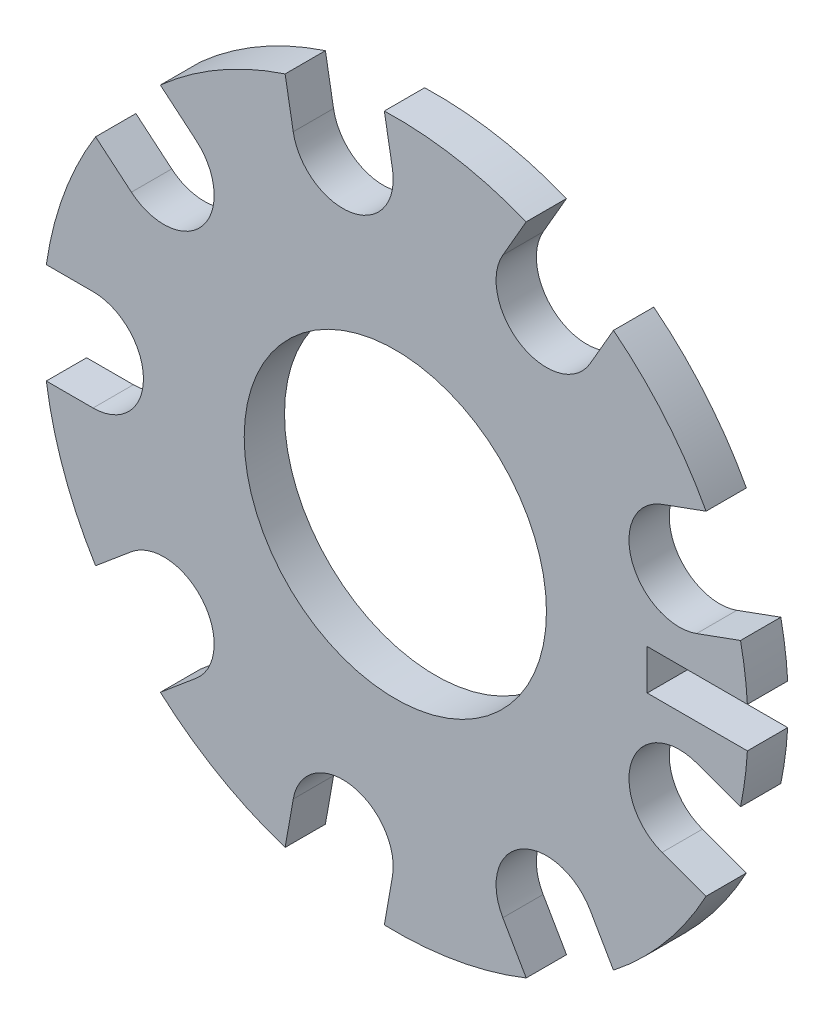
from build123d import *

# Parameters (mm, degrees)
SKETCH1_R           = 17.5
BOSS_EXTRUDE1_DEPTH = 2
CUT_EXTRUDE2_START  = -5
CUT_EXTRUDE2_DEPTH  = 5
SKETCH4_R           = 7.5
CUT_EXTRUDE3_DEPTH  = 5
CUT_EXTRUDE5_START  = -2
CUT_EXTRUDE5_DEPTH  = 2
CIRPATTERN4_COUNT   = 9


with BuildPart() as part:
    # Sketch1 → Boss-Extrude1 (new body)
    with BuildSketch(Plane.XY):
        Circle(SKETCH1_R)
    extrude(amount=BOSS_EXTRUDE1_DEPTH)

    # Sketch3 → Cut-Extrude2 (cut)
    with BuildSketch(Plane.XY.offset(2).offset(CUT_EXTRUDE2_START)):
        with BuildLine():
            Line((12.5, -1), (17.47140521, -1))
            ThreePointArc((17.47140521, -1), (17.492849842, -0.500204374), (17.5, 0))
            ThreePointArc((17.5, 0), (17.492849842, 0.500204374), (17.47140521, 1))
            Line((17.47140521, 1), (12.5, 1))
            Line((12.5, 1), (12.5, -1))
        make_face()
    extrude(amount=CUT_EXTRUDE2_DEPTH, mode=Mode.SUBTRACT)

    # Sketch4 → Cut-Extrude3 (cut)
    with BuildSketch(Plane.XY.offset(2)):
        Circle(SKETCH4_R)
    extrude(amount=-CUT_EXTRUDE3_DEPTH, mode=Mode.SUBTRACT)

    # Sketch2 → Cut-Extrude5 (cut)
    with BuildSketch(Plane.XY.offset(2).offset(CUT_EXTRUDE5_START)):
        with BuildLine():
            Line((-17.320508076, -2.5), (-15, -2.5))
            ThreePointArc((-15, -2.5), (-13.232233047, -1.767766953), (-12.5, 0))
            ThreePointArc((-12.5, 0), (-13.232233047, 1.767766953), (-15, 2.5))
            Line((-15, 2.5), (-17.320508076, 2.5))
            ThreePointArc((-17.320508076, 2.5), (-17.5, 0), (-17.320508076, -2.5))
        make_face()
    cut_extrude5 = extrude(amount=CUT_EXTRUDE5_DEPTH, mode=Mode.SUBTRACT)

    # CirPattern4: Cut-Extrude5 ×9 about axis
    cirpattern4_axis = Axis((0, 0, 0), (0, 0, 1))
    for i in range(1, CIRPATTERN4_COUNT):
        add(cut_extrude5.rotate(cirpattern4_axis, i * 360 / CIRPATTERN4_COUNT), mode=Mode.SUBTRACT)


solid = part.part
